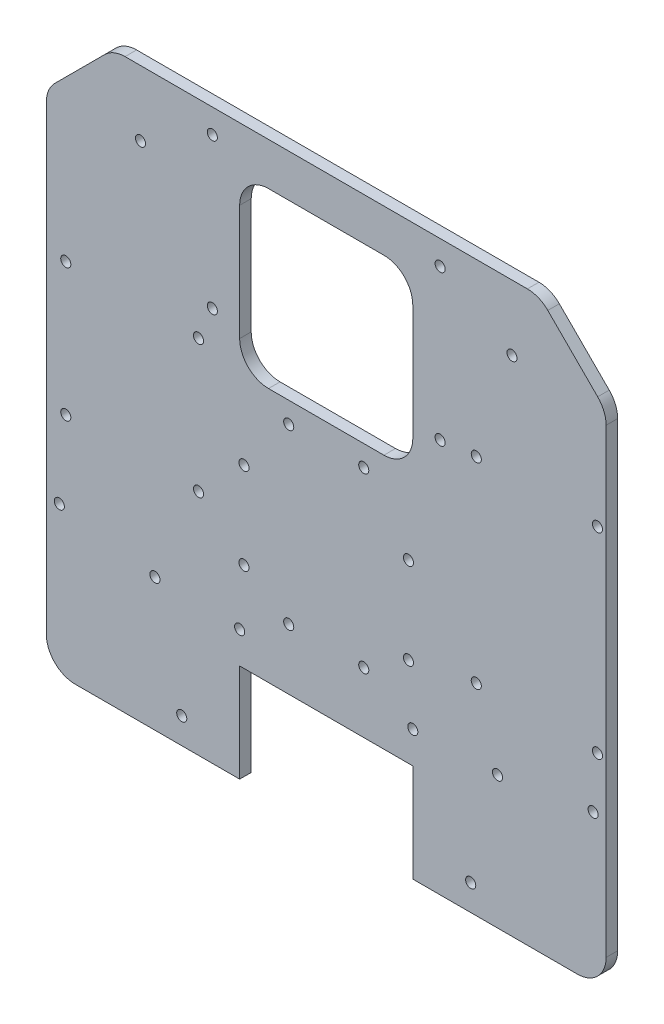
from build123d import *

# Parameters (mm, degrees)
EXTRUDE_1_DEPTH      = 4
SKETCH_6_R           = 1.75
CUT_EXTRUDE_3_DEPTH  = 4
SKETCH_4_R           = 1.75
CUT_EXTRUDE_4_DEPTH  = 4
SKETCH_7_R           = 1.75
CUT_EXTRUDE_5_DEPTH  = 4
SKETCH_8_R           = 1.75
CUT_EXTRUDE_6_DEPTH  = 4
CUT_EXTRUDE_7_DEPTH  = 4
SKETCH_10_R          = 1.75
SKETCH_10_R_2        = 1.749999998
CUT_EXTRUDE_9_DEPTH  = 4
CUT_EXTRUDE_10_REACH = 358.759
SKETCH_11_R          = 1.75
SKETCH_12_R          = 1.75
CUT_EXTRUDE_13_DEPTH = 357.758930869
SKETCH_13_W          = 60
SKETCH_13_H          = 33.978821531
CUT_EXTRUDE_14_DEPTH = 10
SKETCH_14_W          = 60
SKETCH_14_H          = 10
CUT_EXTRUDE_16_DEPTH = 10


with BuildPart() as part:
    # 草图3 → 凸台-拉伸1 (new body)
    with BuildSketch(Plane.XY):
        with BuildLine():
            Line((73.505746565, 259.089488009), (196.937204075, 259.089488009))
            ThreePointArc((196.937204075, 259.089488009), (204.590872722, 257.56707866), (211.079339699, 253.231623633))
            Line((211.079339699, 253.231623633), (239.363610944, 224.947352388))
            ThreePointArc((239.363610944, 224.947352388), (243.69906597, 218.458885412), (245.22147532, 210.805216764))
            Line((245.22147532, 210.805216764), (245.22147532, 54.089488009))
            ThreePointArc((245.22147532, 54.089488009), (239.363610944, 39.947352386), (225.22147532, 34.089488009))
            Line((225.22147532, 34.089488009), (45.221475318, 34.089488009))
            ThreePointArc((45.221475318, 34.089488009), (31.079339694, 39.947352386), (25.221475318, 54.089488009))
            Line((25.221475318, 54.089488009), (25.221475318, 210.805216762))
            ThreePointArc((25.221475318, 210.805216762), (26.743884667, 218.458885409), (31.079339694, 224.947352386))
            Line((31.079339694, 224.947352386), (59.363610941, 253.231623633))
            ThreePointArc((59.363610941, 253.231623633), (65.852077918, 257.56707866), (73.505746565, 259.089488009))
        make_face()
    extrude(amount=EXTRUDE_1_DEPTH)

    # 草图6 → 切除-拉伸3 (cut)
    with BuildSketch(Plane.XY.offset(4)):
        with Locations((187.22147532, 181.880072532)):
            Circle(SKETCH_6_R)
        with Locations((229.22147532, 181.880072532)):
            Circle(SKETCH_6_R)
        with Locations((229.22147532, 113.880072532)):
            Circle(SKETCH_6_R)
        with Locations((187.22147532, 113.880072532)):
            Circle(SKETCH_6_R)
    extrude(amount=-CUT_EXTRUDE_3_DEPTH, mode=Mode.SUBTRACT)

    # 草图4 → 切除-拉伸4 (cut)
    with BuildSketch(Plane.XY.offset(4)):
        with Locations((174.691475319, 232.74535793)):
            Circle(SKETCH_4_R)
        with Locations(Location((174.691475319, 180.63535793, 0), (0, 0, 180))):
            Circle(SKETCH_4_R)
        with Locations((95.751475319, 180.63535793)):
            Circle(SKETCH_4_R)
        with Locations(Location((95.751475319, 232.74535793, 0), (0, 0, 180))):
            Circle(SKETCH_4_R)
        with Locations((165.22147532, 89.06830954)):
            Circle(SKETCH_4_R)
        with Locations(Location((105.22147532, 89.06830954, 0), (0, 0, 180))):
            Circle(SKETCH_4_R)
    extrude(amount=-CUT_EXTRUDE_4_DEPTH, mode=Mode.SUBTRACT)

    # 草图7 → 切除-拉伸5 (cut)
    with BuildSketch(Plane.XY.offset(4)):
        with Locations((122.221475319, 159.089488009)):
            Circle(SKETCH_7_R)
        with Locations((148.221475319, 159.089488009)):
            Circle(SKETCH_7_R)
        with Locations((122.221475319, 99.089488009)):
            Circle(SKETCH_7_R)
        with Locations((148.221475319, 99.089488009)):
            Circle(SKETCH_7_R)
    extrude(amount=-CUT_EXTRUDE_5_DEPTH, mode=Mode.SUBTRACT)

    # 草图8 → 切除-拉伸6 (cut)
    with BuildSketch(Plane.XY.offset(4)):
        with Locations((227.720064334, 95.494716411)):
            Circle(SKETCH_8_R)
        with Locations((185.293657462, 53.06830954)):
            Circle(SKETCH_8_R)
        with Locations(Location((42.722886307, 95.494716411, 0), (0, 0, 180))):
            Circle(SKETCH_8_R)
        with Locations(Location((85.149293178, 53.06830954, 0), (0, 0, 180))):
            Circle(SKETCH_8_R)
    extrude(amount=-CUT_EXTRUDE_6_DEPTH, mode=Mode.SUBTRACT)

    # 草图9 → 切除-拉伸7 (cut)
    with BuildSketch(Plane.XY.offset(4)):
        with BuildLine():
            Line((115.22147532, 166.324698125), (155.22147532, 166.324698125))
            ThreePointArc((155.22147532, 166.324698125), (162.292543132, 169.253630313), (165.22147532, 176.324698125))
            Line((165.22147532, 176.324698125), (165.22147532, 216.324698125))
            ThreePointArc((165.22147532, 216.324698125), (162.292543132, 223.395765937), (155.22147532, 226.324698125))
            Line((155.22147532, 226.324698125), (135.22147532, 226.324698125))
            Line((135.22147532, 226.324698125), (115.22147532, 226.324698125))
            ThreePointArc((115.22147532, 226.324698125), (108.150407508, 223.395765937), (105.22147532, 216.324698125))
            Line((105.22147532, 216.324698125), (105.22147532, 196.104283633))
            Line((105.22147532, 196.104283633), (105.22147532, 176.324698125))
            ThreePointArc((105.22147532, 176.324698125), (108.150407508, 169.253630313), (115.22147532, 166.324698125))
        make_face()
    extrude(amount=-CUT_EXTRUDE_7_DEPTH, mode=Mode.SUBTRACT)

    # 草图10 → 切除-拉伸9 (cut)
    with BuildSketch(Plane.XY.offset(4)):
        with Locations((106.721475319, 109.089488009)):
            Circle(SKETCH_10_R)
        with Locations((163.721475321, 109.089488009)):
            Circle(SKETCH_10_R_2)
        with Locations((106.721475319, 139.089488009)):
            Circle(SKETCH_10_R)
        with Locations(Location((163.721475321, 139.089488009, 0), (0, 0, 180))):
            Circle(SKETCH_10_R)
    extrude(amount=-CUT_EXTRUDE_9_DEPTH, mode=Mode.SUBTRACT)

    # 草图11 → 切除-拉伸10 (cut, up to next)
    with BuildSketch(Plane.XY.offset(4), mode=Mode.PRIVATE) as cut_extrude_10_sk1:
        with Locations((70.852077918, 218.458885409)):
            Circle(SKETCH_11_R)
    cut_extrude_10_tool1 = extrude(cut_extrude_10_sk1.sketch, amount=-CUT_EXTRUDE_10_REACH, mode=Mode.PRIVATE) & part.part
    # 草图11 → 切除-拉伸10 (cut, up to next)
    with BuildSketch(Plane.XY.offset(4), mode=Mode.PRIVATE) as cut_extrude_10_sk2:
        with Locations((75.852077918, 90.084611013)):
            Circle(SKETCH_11_R)
    cut_extrude_10_tool2 = extrude(cut_extrude_10_sk2.sketch, amount=-CUT_EXTRUDE_10_REACH, mode=Mode.PRIVATE) & part.part
    # 草图11 → 切除-拉伸10 (cut, up to next)
    with BuildSketch(Plane.XY.offset(4), mode=Mode.PRIVATE) as cut_extrude_10_sk3:
        with Locations((194.590872722, 90.084611013)):
            Circle(SKETCH_11_R)
    cut_extrude_10_tool3 = extrude(cut_extrude_10_sk3.sketch, amount=-CUT_EXTRUDE_10_REACH, mode=Mode.PRIVATE) & part.part
    # 草图11 → 切除-拉伸10 (cut, up to next)
    with BuildSketch(Plane.XY.offset(4), mode=Mode.PRIVATE) as cut_extrude_10_sk4:
        with Locations((199.590872722, 218.458885409)):
            Circle(SKETCH_11_R)
    cut_extrude_10_tool4 = extrude(cut_extrude_10_sk4.sketch, amount=-CUT_EXTRUDE_10_REACH, mode=Mode.PRIVATE) & part.part
    add(cut_extrude_10_tool1.solids().sort_by_distance((70.852078, 218.458885, 4))[0], mode=Mode.SUBTRACT)
    add(cut_extrude_10_tool2.solids().sort_by_distance((75.852078, 90.084611, 4))[0], mode=Mode.SUBTRACT)
    add(cut_extrude_10_tool3.solids().sort_by_distance((194.590873, 90.084611, 4))[0], mode=Mode.SUBTRACT)
    add(cut_extrude_10_tool4.solids().sort_by_distance((199.590873, 218.458885, 4))[0], mode=Mode.SUBTRACT)

    # 草图12 → 切除-拉伸13 (cut, through all)
    with BuildSketch(Plane.XY.offset(4)):
        with Locations((90.961423691, 169.312171827)):
            Circle(SKETCH_12_R)
        with Locations((90.961423691, 123.312171827)):
            Circle(SKETCH_12_R)
        with Locations((44.961423691, 123.312171827)):
            Circle(SKETCH_12_R)
        with Locations((44.961423691, 169.312171827)):
            Circle(SKETCH_12_R)
    extrude(amount=-CUT_EXTRUDE_13_DEPTH, mode=Mode.SUBTRACT)

    # 草图13 → 切除-拉伸14 (cut)
    with BuildSketch(Plane.XY.offset(4)):
        with Locations((135.22147532, 51.078898775)):
            Rectangle(SKETCH_13_W, SKETCH_13_H)
    extrude(amount=-CUT_EXTRUDE_14_DEPTH, mode=Mode.SUBTRACT)

    # 草图14 → 切除-拉伸16 (cut)
    with BuildSketch(Plane.XY):
        with BuildLine():
            Line((38.221475318, 210.805216762), (38.221475318, 213.805216762))
            ThreePointArc((38.221475318, 213.805216762), (38.982679993, 217.632051085), (41.150407506, 220.876284574))
            Line((41.150407506, 220.876284574), (58.434678753, 238.160555821))
            ThreePointArc((58.434678753, 238.160555821), (61.678912242, 240.328283334), (65.505746565, 241.089488009))
            Line((65.505746565, 241.089488009), (73.505746565, 241.089488009))
            Line((73.505746565, 241.089488009), (196.937204075, 241.089488009))
            Line((196.937204075, 241.089488009), (204.937204075, 241.089488009))
            ThreePointArc((204.937204075, 241.089488009), (208.764038399, 240.328283334), (212.008271887, 238.160555821))
            Line((212.008271887, 238.160555821), (229.292543132, 220.876284576))
            ThreePointArc((229.292543132, 220.876284576), (231.460270645, 217.632051088), (232.22147532, 213.805216764))
            Line((232.22147532, 213.805216764), (232.22147532, 54.089488009))
            ThreePointArc((232.22147532, 54.089488009), (229.292543132, 47.018420197), (222.22147532, 44.089488009))
            Line((222.22147532, 44.089488009), (175.22147532, 44.089488009))
            Line((175.22147532, 44.089488009), (165.22147532, 44.089488009))
            Line((165.22147532, 44.089488009), (165.22147532, 34.089488009))
            Line((165.22147532, 34.089488009), (225.22147532, 34.089488009))
            ThreePointArc((225.22147532, 34.089488009), (239.363610944, 39.947352386), (245.22147532, 54.089488009))
            Line((245.22147532, 54.089488009), (245.22147532, 210.805216764))
            ThreePointArc((245.22147532, 210.805216764), (243.69906597, 218.458885412), (239.363610944, 224.947352388))
            Line((239.363610944, 224.947352388), (211.079339699, 253.231623633))
            ThreePointArc((211.079339699, 253.231623633), (204.590872722, 257.56707866), (196.937204075, 259.089488009))
            Line((196.937204075, 259.089488009), (73.505746565, 259.089488009))
            ThreePointArc((73.505746565, 259.089488009), (65.852077918, 257.56707866), (59.363610941, 253.231623633))
            Line((59.363610941, 253.231623633), (31.079339694, 224.947352386))
            ThreePointArc((31.079339694, 224.947352386), (26.743884667, 218.458885409), (25.221475318, 210.805216762))
            Line((25.221475318, 210.805216762), (25.221475318, 54.089488009))
            ThreePointArc((25.221475318, 54.089488009), (31.079339694, 39.947352386), (45.221475318, 34.089488009))
            Line((45.221475318, 34.089488009), (105.22147532, 34.089488009))
            Line((105.22147532, 34.089488009), (105.22147532, 44.089488009))
            Line((105.22147532, 44.089488009), (95.22147532, 44.089488009))
            Line((95.22147532, 44.089488009), (48.221475318, 44.089488009))
            ThreePointArc((48.221475318, 44.089488009), (41.150407506, 47.018420197), (38.221475318, 54.089488009))
            Line((38.221475318, 54.089488009), (38.221475318, 210.805216762))
        make_face()
        with Locations((135.22147532, 73.06830954)):
            Rectangle(SKETCH_14_W, SKETCH_14_H)
    extrude(amount=CUT_EXTRUDE_16_DEPTH, mode=Mode.SUBTRACT)


solid = part.part
